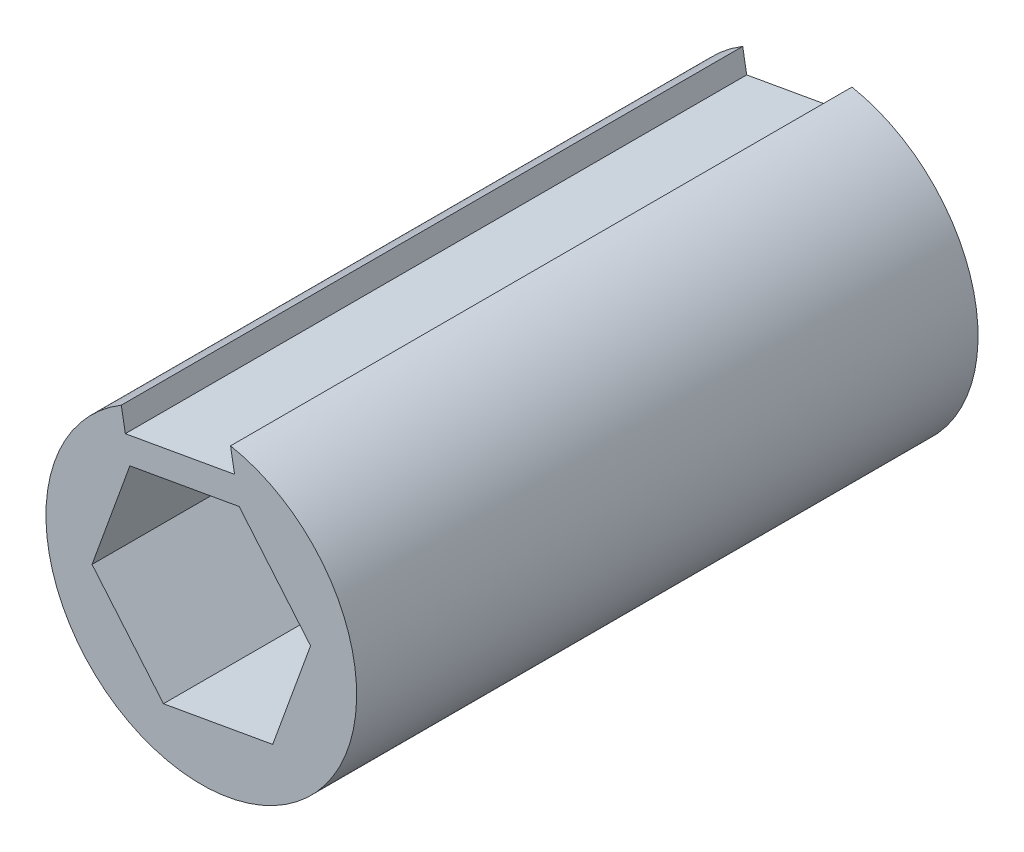
from build123d import *

# Parameters (mm, degrees)
SZKIC1_R                    = 7
DODANIE_WYCI_GNI_CIE1_DEPTH = 28
WYTNIJ_WYCI_GNI_CIE1_DEPTH  = 30.69848481


with BuildPart() as part:
    # Szkic1 → Dodanie-wyciągnięcie1 (new body)
    with BuildSketch(Plane.XY):
        Circle(SZKIC1_R)
        Polygon((4.922995461, 0.874137115), (1.704472782, 4.700507689), (-3.218522678, 3.826370574), (-4.922995461, -0.874137115), (-1.704472782, -4.700507689), (3.218522678, -3.826370574), align=None, mode=Mode.SUBTRACT)
    extrude(amount=DODANIE_WYCI_GNI_CIE1_DEPTH)

    # Szkic2 → Wytnij-wyciągnięcie1 (cut, through all)
    with BuildSketch(Plane.XY.offset(28)):
        Polygon((-3.423048557, 4.978226449), (1.499946904, 5.852363564), (1.23770577, 7.329262202), (-3.685289691, 6.455125087), align=None)
    extrude(amount=-WYTNIJ_WYCI_GNI_CIE1_DEPTH, mode=Mode.SUBTRACT)


solid = part.part
